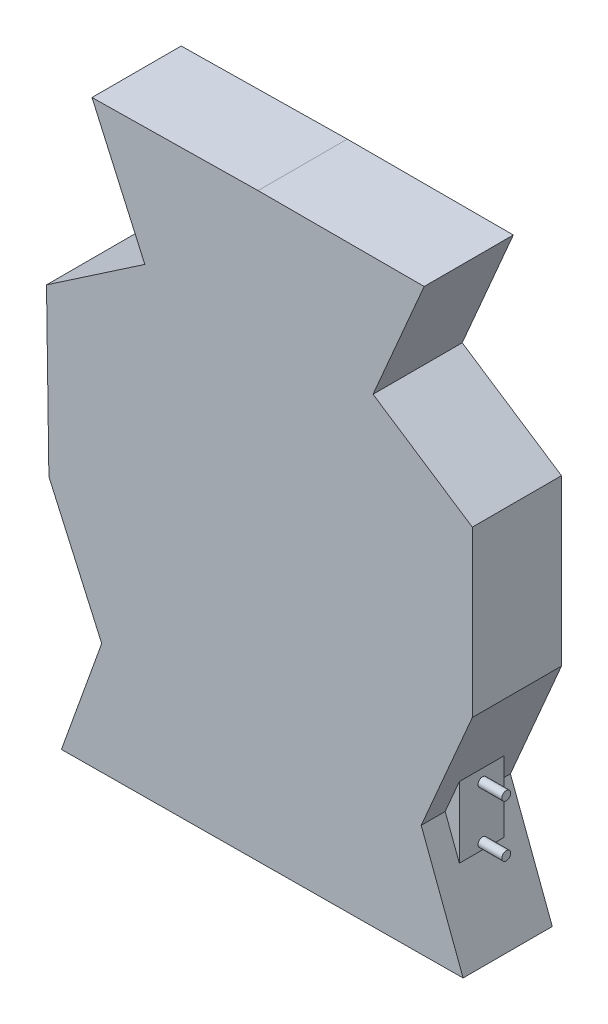
from build123d import *

# Parameters (mm, degrees)
BOSS_EXTRUDE1_DEPTH = 30
SKETCH6_W           = 15
SKETCH6_H           = 30
BOSS_EXTRUDE2_DEPTH = 24
BOSS_EXTRUDE5_DEPTH = 10
SKETCH15_R          = 1.5
BOSS_EXTRUDE7_DEPTH = 8
SKETCH7_R           = 1.5
BOSS_EXTRUDE8_DEPTH = 8


with BuildPart() as part:
    # Sketch2 → Boss-Extrude1 (new body)
    with BuildSketch(Plane.XY):
        Polygon((-35.659220441, 48.994166095), (20.212047263, 48.994166095), (3.020324726, 8.994166095), (36.417587641, -13.019984577), (36.417587641, -68.485610583), (19.225865104, -108.485610583), (33.318130441, -145.920995684), (-101.80917988, -146.898605829), (-88.260031439, -109.263242453), (-106.02870282, -69.516171603), (-106.831218915, -14.056351587), (-73.755968311, 8.438710038), (-91.524639692, 48.185780888), align=None)
    extrude(amount=BOSS_EXTRUDE1_DEPTH)

    # Sketch6 → Boss-Extrude2 (add)
    with BuildSketch(Plane(origin=(0, 0, 0), x_dir=(0, 0, -1), z_dir=(1, 0, 0))):
        with Locations((-14.441506787, -108.571370402)):
            Rectangle(SKETCH6_W, SKETCH6_H)
    extrude(amount=BOSS_EXTRUDE2_DEPTH)

    # Sketch13 → Boss-Extrude5 (add, symmetric)
    with BuildSketch(Plane(origin=(0, 0, 15), x_dir=(-1, 0, 0), z_dir=(0, 0, -1))):
        Polygon((92.491049439, -97.377625596), (87.716914543, -108.485610583), (92.491049439, -121.167856773), align=None)
    extrude(amount=BOSS_EXTRUDE5_DEPTH, both=True)

    # Sketch15 → Boss-Extrude7 (add, symmetric)
    with BuildSketch(Plane.ZY.offset(92.491049439)):
        with Locations(Location((14.163706185, -101.373718374, 0), (0, 0, 180))):
            Circle(SKETCH15_R)
        with Locations(Location((14.163706185, -118.873718374, 0), (0, 0, 180))):
            Circle(SKETCH15_R)
    extrude(amount=BOSS_EXTRUDE7_DEPTH, both=True)

    # Sketch7 → Boss-Extrude8 (add, symmetric)
    with BuildSketch(Plane(origin=(24, 0, 0), x_dir=(0, 0, -1), z_dir=(1, 0, 0))):
        with Locations((-14.163706185, -118.873718374)):
            Circle(SKETCH7_R)
        with Locations((-14.163706185, -101.373718374)):
            Circle(SKETCH7_R)
    extrude(amount=BOSS_EXTRUDE8_DEPTH, both=True)


solid = part.part
